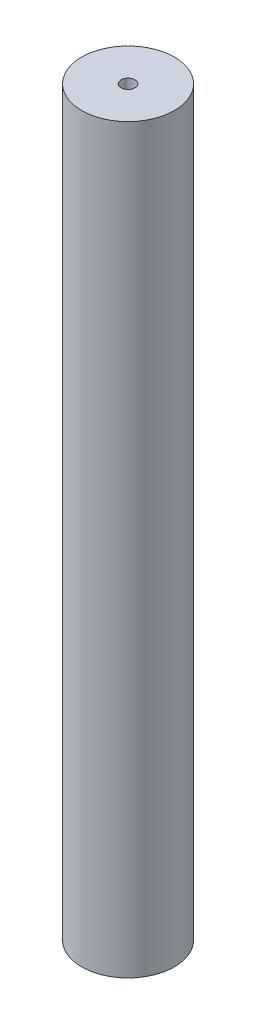
from build123d import *


with BuildPart() as part:
    # Sketch1 → Revolve1 (revolve)
    with BuildSketch(Plane.XY, mode=Mode.PRIVATE) as revolve1_sk:
        Polygon((0, 0), (3, 0), (3, 76), (0.75, 76), (0.75, 78), (3.60271381, 78), (5, 78), (5, -2), (0, -2), align=None)
    revolve(revolve1_sk.sketch.rotate(Axis((0, -77.080589312, 0), (0, 1, 0)), 90), axis=Axis((0, -77.080589312, 0), (0, 1, 0)))


solid = part.part
